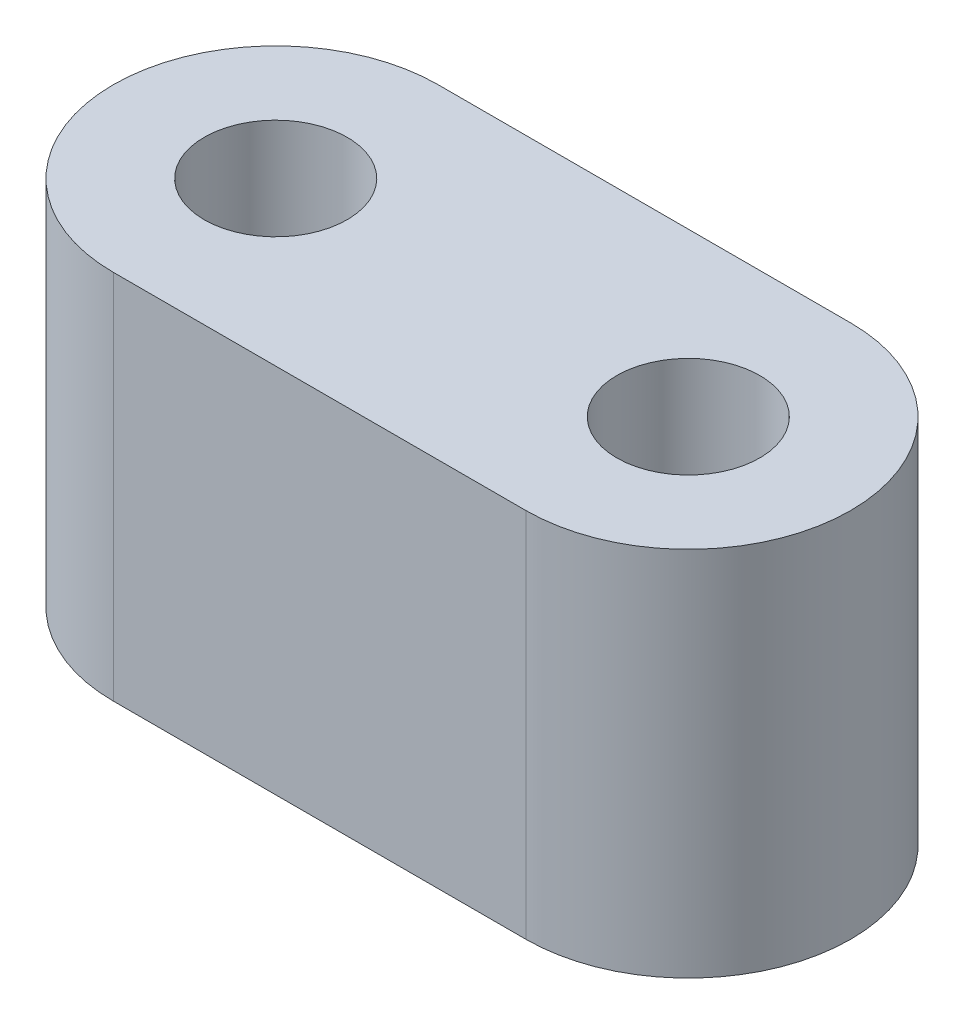
from build123d import *

# Parameters (mm, degrees)
SKETCH1_R           = 2.2
BOSS_EXTRUDE1_DEPTH = 11.43


with BuildPart() as part:
    # Sketch1 → Boss-Extrude1 (new body)
    with BuildSketch(Plane(origin=(0, 0, 0), x_dir=(1, 0, 0), z_dir=(0, 1, 0))):
        with BuildLine():
            Line((0, 5), (12.7, 5))
            ThreePointArc((12.7, 5), (17.7, 0), (12.7, -5))
            Line((12.7, -5), (0, -5))
            ThreePointArc((0, -5), (-5, 0), (0, 5))
        make_face()
        with Locations(Location((0, 0, 0), (0, 0, 270))):
            Circle(SKETCH1_R, mode=Mode.SUBTRACT)
        with Locations(Location((12.7, 0, 0), (0, 0, 270))):
            Circle(SKETCH1_R, mode=Mode.SUBTRACT)
    extrude(amount=BOSS_EXTRUDE1_DEPTH)


solid = part.part
